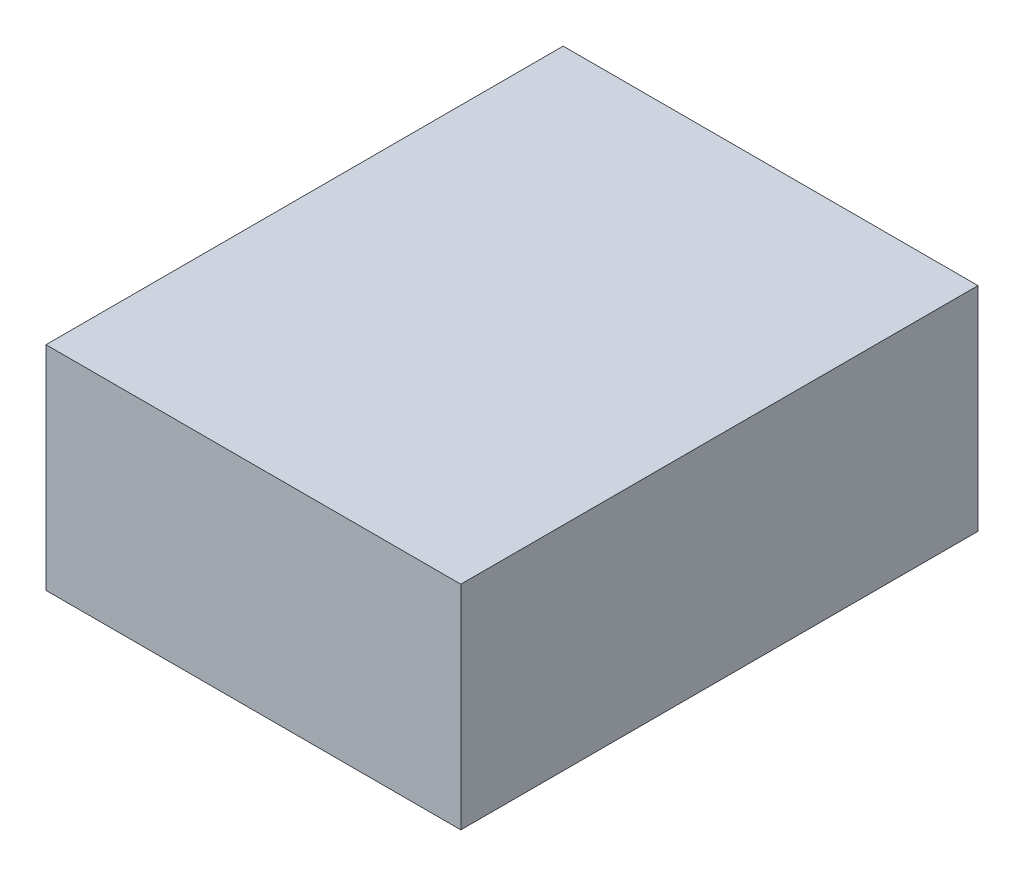
from build123d import *

# Parameters (mm, degrees)
SKETCH1_W           = 7.7
SKETCH1_H           = 3.95
BOSS_EXTRUDE1_DEPTH = 9.6


with BuildPart() as part:
    # Sketch1 → Boss-Extrude1 (new body)
    with BuildSketch(Plane.XY):
        with Locations((3.85, 1.975)):
            Rectangle(SKETCH1_W, SKETCH1_H)
    extrude(amount=BOSS_EXTRUDE1_DEPTH)


solid = part.part
